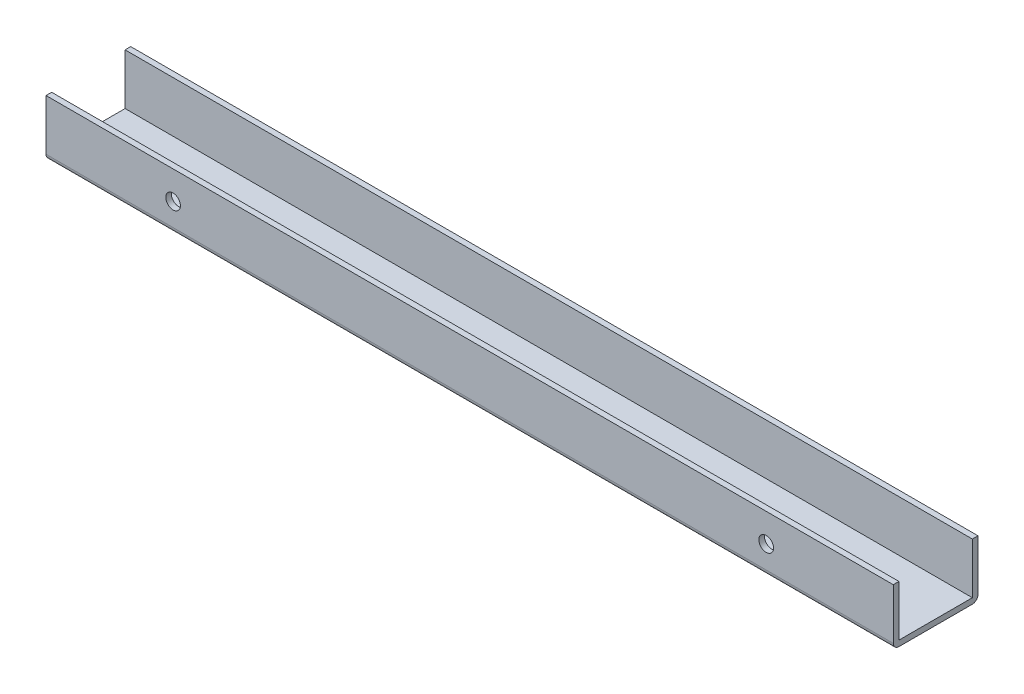
from build123d import *

# Parameters (mm, degrees)
EXTRUDE1_DEPTH     = 1500
SKETCH2_R          = 13
CUT_EXTRUDE1_DEPTH = 10


with BuildPart() as part:
    # Sketch1 → Extrude1 (new body)
    with BuildSketch(Plane(origin=(0, 0, 0), x_dir=(0, 0, -1), z_dir=(1, 0, 0))):
        with BuildLine():
            Line((140, 10), (140, 100))
            Line((140, 100), (150, 100))
            Line((150, 100), (150, 10))
            ThreePointArc((150, 10), (147.071067812, 2.928932188), (140, 0))
            Line((140, 0), (10, 0))
            ThreePointArc((10, 0), (2.928932188, 2.928932188), (0, 10))
            Line((0, 10), (0, 100))
            Line((0, 100), (10, 100))
            Line((10, 100), (10, 10))
            Line((10, 10), (140, 10))
        make_face()
    extrude(amount=EXTRUDE1_DEPTH)

    # Sketch2 → Cut-Extrude1 (cut)
    with BuildSketch(Plane.XY):
        with Locations((225, 50)):
            Circle(SKETCH2_R)
        with Locations((1275, 50)):
            Circle(SKETCH2_R)
    extrude(amount=-CUT_EXTRUDE1_DEPTH, mode=Mode.SUBTRACT)


solid = part.part
